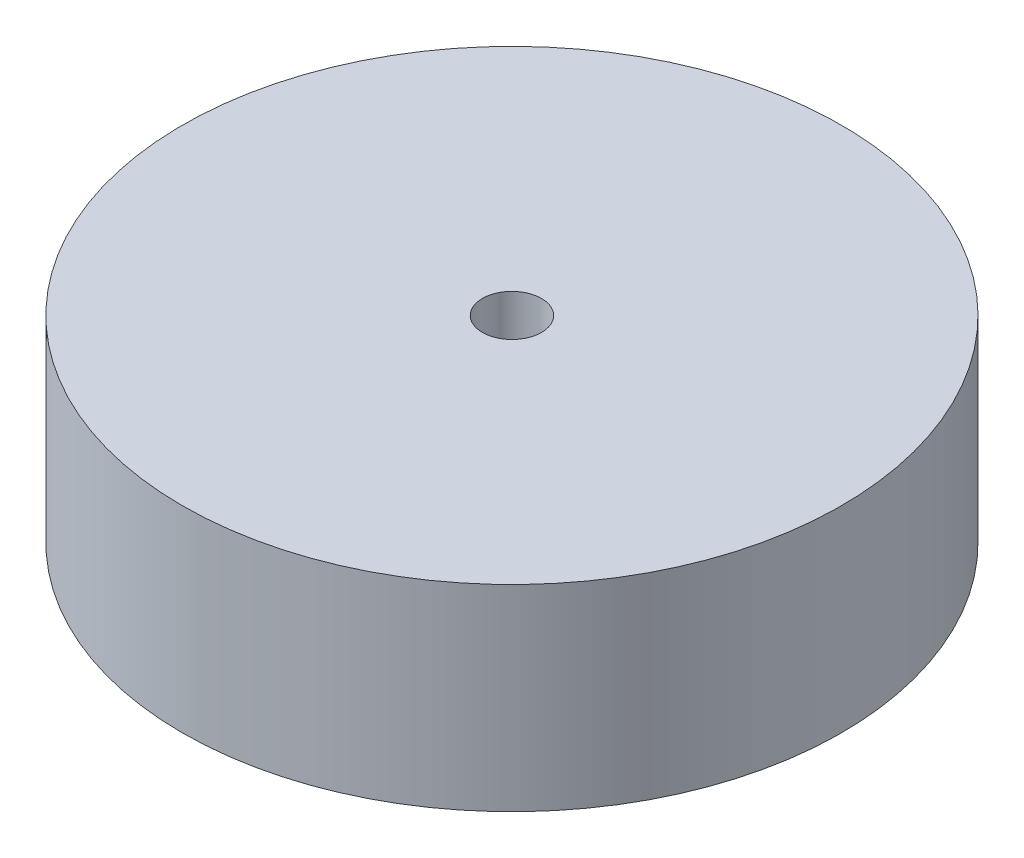
from build123d import *

# Parameters (mm, degrees)
SKETCH1_R           = 33.5
SKETCH1_R_2         = 3
BOSS_EXTRUDE1_DEPTH = 20


with BuildPart() as part:
    # Sketch1 → Boss-Extrude1 (new body)
    with BuildSketch(Plane(origin=(0, 0, 0), x_dir=(1, 0, 0), z_dir=(0, 1, 0))):
        with Locations(Location((0, 0, 0), (0, 0, 270))):
            Circle(SKETCH1_R)
        with Locations(Location((0, 0, 0), (0, 0, 270))):
            Circle(SKETCH1_R_2, mode=Mode.SUBTRACT)
    extrude(amount=BOSS_EXTRUDE1_DEPTH)


solid = part.part
